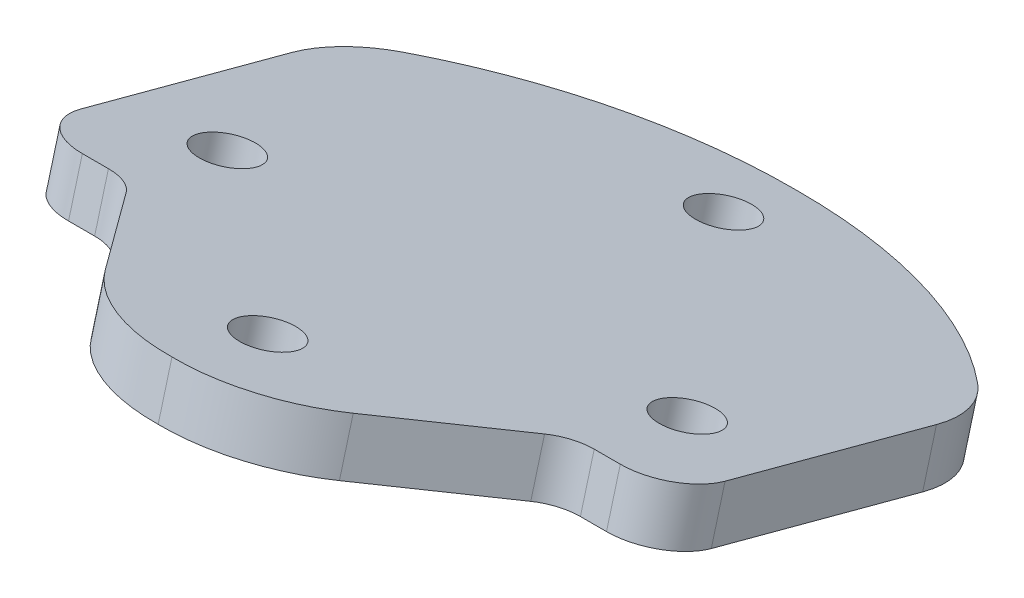
from build123d import *

# Parameters (mm, degrees)
SKETCH1_R      = 1.7272
EXTRUDE1_DEPTH = 3.175


with BuildPart() as part:
    # Sketch1 → Extrude1 (new body)
    with BuildSketch(Plane(origin=(0, 8.832630516, -2.366696214), x_dir=(1, 0, 0), z_dir=(0, 0.9659258262890681, -0.25881904510252135))):
        with BuildLine():
            Line((6.232958536, -16.463411329), (6.232958536, -29.501422299))
            ThreePointArc((6.232958536, -29.501422299), (5.303022566, -31.746486329), (3.057958536, -32.676422299))
            Line((3.057958536, -32.676422299), (1.503815544, -32.676422299))
            ThreePointArc((1.503815544, -32.676422299), (0.385985087, -32.93562089), (-0.503703576, -33.660315947))
            Line((-0.503703576, -33.660315947), (-5.578238388, -40.206928682))
            ThreePointArc((-5.578238388, -40.206928682), (-8.853459375, -42.848154666), (-12.965757523, -43.738183401))
            ThreePointArc((-12.965757523, -43.738183401), (-17.07805567, -42.848154665), (-20.353276656, -40.206928682))
            Line((-20.353276656, -40.206928682), (-25.427811468, -33.660315947))
            ThreePointArc((-25.427811468, -33.660315947), (-26.317500131, -32.93562089), (-27.435330589, -32.676422299))
            Line((-27.435330589, -32.676422299), (-28.98947358, -32.676422299))
            ThreePointArc((-28.98947358, -32.676422299), (-31.234537611, -31.746486329), (-32.16447358, -29.501422299))
            Line((-32.16447358, -29.501422299), (-32.16447358, -16.463411329))
            ThreePointArc((-32.16447358, -16.463411329), (-31.6135685, -13.876328394), (-30.056442678, -11.738139043))
            ThreePointArc((-30.056442678, -11.738139043), (-22.115977586, -6.903610393), (-12.965757522, -5.261317506))
            ThreePointArc((-12.965757522, -5.261317506), (-3.815537458, -6.903610394), (4.124927634, -11.738139043))
            ThreePointArc((4.124927634, -11.738139043), (5.682053455, -13.876328394), (6.232958536, -16.463411329))
        make_face()
        with Locations(Location((0.916706492, -26.332658417, 0), (0, 0, 270))):
            Circle(SKETCH1_R, mode=Mode.SUBTRACT)
        with Locations(Location((-12.782344336, -38.025699687, 0), (0, 0, 270))):
            Circle(SKETCH1_R, mode=Mode.SUBTRACT)
        with Locations(Location((-26.481395164, -26.332658417, 0), (0, 0, 270))):
            Circle(SKETCH1_R, mode=Mode.SUBTRACT)
        with Locations(Location((-12.782344336, -9.91136031, 0), (0, 0, 270))):
            Circle(SKETCH1_R, mode=Mode.SUBTRACT)
    extrude(amount=EXTRUDE1_DEPTH)


solid = part.part
